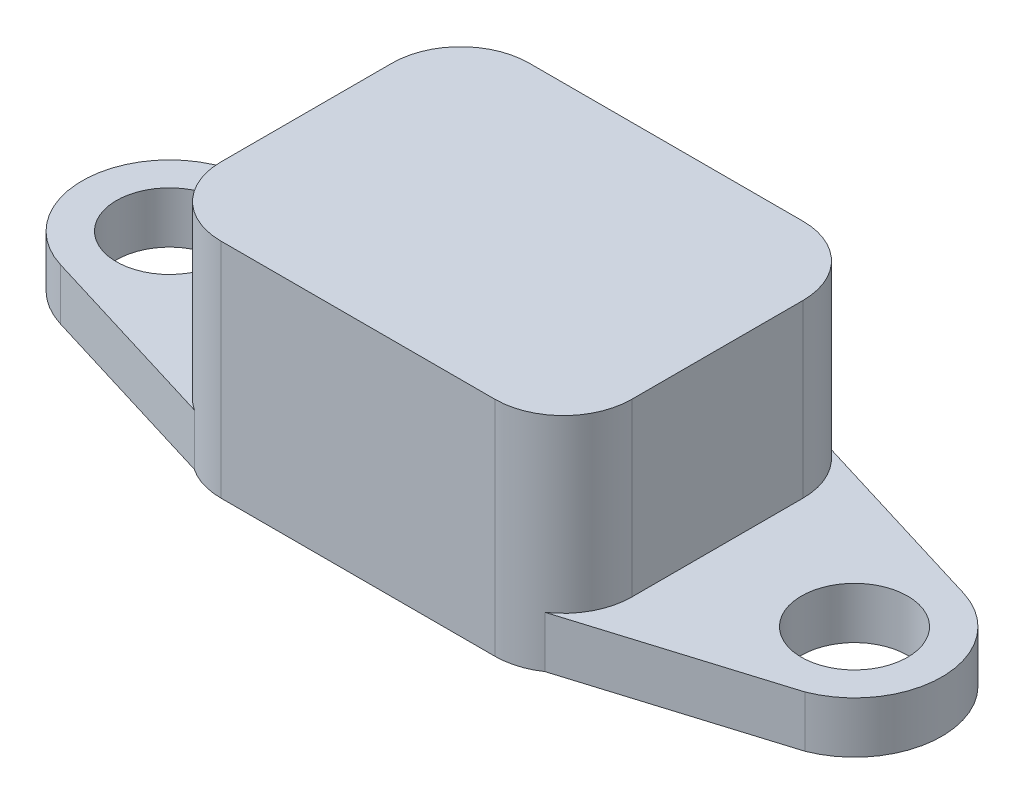
from build123d import *

# Parameters (mm, degrees)
BOSS_EXTRUDE1_DEPTH = 12
BOSS_EXTRUDE2_DEPTH = 1
SKETCH3_R           = 3.1
BOSS_EXTRUDE3_DEPTH = 3
SKETCH4_W           = 0.75982906
SKETCH4_H           = 4.341880342
SKETCH4_H_2         = 3.093589744
CUT_EXTRUDE1_DEPTH  = 0.5


with BuildPart() as part:
    # Sketch1 → Boss-Extrude1 (new body)
    with BuildSketch(Plane(origin=(0, 0, 0), x_dir=(1, 0, 0), z_dir=(0, 1, 0))):
        with BuildLine():
            Line((-8, 9), (8, 9))
            ThreePointArc((8, 9), (10.828427125, 7.828427125), (12, 5))
            Line((12, 5), (12, -5))
            ThreePointArc((12, -5), (10.828427125, -7.828427125), (8, -9))
            Line((8, -9), (-8, -9))
            ThreePointArc((-8, -9), (-10.828427125, -7.828427125), (-12, -5))
            Line((-12, -5), (-12, 5))
            ThreePointArc((-12, 5), (-10.828427125, 7.828427125), (-8, 9))
        make_face()
        with BuildLine():
            Line((-8, 8), (8, 8))
            ThreePointArc((8, 8), (10.121320344, 7.121320344), (11, 5))
            Line((11, 5), (11, -5))
            ThreePointArc((11, -5), (10.121320344, -7.121320344), (8, -8))
            Line((8, -8), (-8, -8))
            ThreePointArc((-8, -8), (-10.121320344, -7.121320344), (-11, -5))
            Line((-11, -5), (-11, 5))
            ThreePointArc((-11, 5), (-10.121320344, 7.121320344), (-8, 8))
        make_face(mode=Mode.SUBTRACT)
    extrude(amount=BOSS_EXTRUDE1_DEPTH)

    # Sketch2 → Boss-Extrude2 (add)
    with BuildSketch(Plane(origin=(0, 12, 0), x_dir=(1, 0, 0), z_dir=(0, 1, 0))):
        with BuildLine():
            Line((-8, -9), (8, -9))
            ThreePointArc((8, -9), (10.828427125, -7.828427125), (12, -5))
            Line((12, -5), (12, 5))
            ThreePointArc((12, 5), (10.828427125, 7.828427125), (8, 9))
            Line((8, 9), (-8, 9))
            ThreePointArc((-8, 9), (-10.828427125, 7.828427125), (-12, 5))
            Line((-12, 5), (-12, -5))
            ThreePointArc((-12, -5), (-10.828427125, -7.828427125), (-8, -9))
        make_face()
    extrude(amount=BOSS_EXTRUDE2_DEPTH)

    # Sketch3 → Boss-Extrude3 (add)
    # profile 1 of 2: a face of its own
    with BuildSketch(Plane.XZ):
        with BuildLine():
            Line((-11.968111741, 5.504072627), (-8, 9))
            Line((-8, 9), (-21.490501833, 4.877335777))
            ThreePointArc((-21.490501833, 4.877335777), (-25.1, 0), (-21.490501833, -4.877335777))
            Line((-21.490501833, -4.877335777), (-8, -9))
            Line((-8, -9), (-10.121320344, -7.828427125))
            Line((-10.121320344, -7.828427125), (-12, -5))
            Line((-12, -5), (-11.968111741, 5.504072627))
        make_face()
        with Locations(Location((-20, 0, 0), (0, 0, 270))):
            Circle(SKETCH3_R, mode=Mode.SUBTRACT)
    # profile 2 of 2: a face of its own
    with BuildSketch(Plane.XZ):
        with BuildLine():
            Line((21.858804444, 4.749194252), (8, 9))
            Line((8, 9), (10.279152272, 7.252036313))
            Line((10.279152272, 7.252036313), (12, 5))
            Line((12, 5), (12, -5))
            Line((12, -5), (10.721069166, -7.315709124))
            Line((10.721069166, -7.315709124), (8, -9))
            Line((8, -9), (21.490501833, -4.877335777))
            ThreePointArc((21.490501833, -4.877335777), (25.096271503, -0.194978886), (21.858804444, 4.749194252))
        make_face()
        with Locations(Location((20, 0, 0), (0, 0, 270))):
            Circle(SKETCH3_R, mode=Mode.SUBTRACT)
    extrude(amount=-BOSS_EXTRUDE3_DEPTH)

    # Sketch4 → Cut-Extrude1 (cut)
    # profile 1 of 12: a face of its own
    with BuildSketch(Plane.XZ.offset(-12)):
        with BuildLine():
            add(Edge.make_bspline(
                [(-5.748700403, 6.706559766), (-5.675098715, 6.704654086), (-5.529792312, 6.700891843), (-5.316099028, 6.669530612), (-5.110166038, 6.618431981), (-4.912086464, 6.547401188), (-4.722356273, 6.454514359), (-4.540306224, 6.342404895), (-4.366588412, 6.208956798), (-4.202982957, 6.057283192), (-4.05178201, 5.892344768), (-3.920766301, 5.714759231), (-3.809040911, 5.529128), (-3.716442609, 5.334953672), (-3.645911766, 5.130891496), (-3.596417357, 4.91798192), (-3.564619651, 4.696285514), (-3.560962425, 4.545340479), (-3.559103715, 4.468625738)],
                knots=[0, 0, 0, 0, 1.014329547, 2.002516266, 2.970391464, 3.935626869, 4.897733899, 5.877609409, 6.878433252, 7.912639331, 8.949961323, 9.958554974, 10.949718813, 11.932905612, 12.9188844, 13.919928257, 14.942845884, 16, 16, 16, 16], degree=3))
            add(Edge.make_bspline(
                [(-3.559103715, 4.468625738), (-3.561083161, 4.392775395), (-3.564983723, 4.243309861), (-3.595119235, 4.023656475), (-3.645447137, 3.813027604), (-3.714781721, 3.610946484), (-3.80570064, 3.418391928), (-3.915247263, 3.234134501), (-4.046312318, 3.059884157), (-4.194115347, 2.895734404), (-4.356833655, 2.74673328), (-4.529178174, 2.615426297), (-4.710353124, 2.504161715), (-4.900093323, 2.412990498), (-5.098805659, 2.342235875), (-5.305999288, 2.292313347), (-5.52166139, 2.261974418), (-5.668322078, 2.258099334), (-5.742764238, 2.256132416)],
                knots=[0, 0, 0, 0, 1.051557043, 2.072126891, 3.067553643, 4.050577992, 5.02905126, 6.015227836, 7.017913613, 8.04756643, 9.074058332, 10.072836633, 11.047628519, 12.017157415, 12.98668631, 13.966869689, 14.968021931, 16, 16, 16, 16], degree=3))
            add(Edge.make_bspline(
                [(-5.742764238, 2.256132416), (-5.820621812, 2.257896838), (-5.973601303, 2.261363688), (-6.197487473, 2.294331847), (-6.411989769, 2.343993411), (-6.615306249, 2.418110632), (-6.809507516, 2.510763389), (-6.993166718, 2.624870815), (-7.166222132, 2.760244338), (-7.327681085, 2.913416991), (-7.473963288, 3.08102147), (-7.603086025, 3.258080739), (-7.712003918, 3.443242221), (-7.800720952, 3.636592575), (-7.870661898, 3.836930177), (-7.919997289, 4.045475139), (-7.949140881, 4.261727295), (-7.953200415, 4.408610083), (-7.955257561, 4.483042138)],
                knots=[0, 0, 0, 0, 1.067978421, 2.098431617, 3.099715153, 4.085208694, 5.062210972, 6.048429807, 7.046490867, 8.072918869, 9.098532598, 10.095778865, 11.076610158, 12.041847152, 13.011192615, 13.984257998, 14.978533688, 16, 16, 16, 16], degree=3))
            add(Edge.make_bspline(
                [(-7.955257561, 4.483042138), (-7.95461191, 4.533116128), (-7.953328783, 4.632630056), (-7.937872171, 4.780104618), (-7.915619093, 4.924700675), (-7.882707846, 5.06584172), (-7.842729093, 5.204523437), (-7.790930971, 5.339454943), (-7.731970691, 5.472077677), (-7.663081155, 5.600825198), (-7.586482652, 5.724512923), (-7.502906865, 5.842557393), (-7.412143644, 5.95353128), (-7.314485368, 6.058163858), (-7.209595493, 6.155767368), (-7.098853737, 6.247723526), (-6.980112355, 6.331589647), (-6.855970223, 6.409413911), (-6.727127225, 6.479789043), (-6.594107871, 6.539690251), (-6.45965262, 6.592000956), (-6.321965333, 6.633286877), (-6.182521573, 6.666913827), (-6.039831667, 6.689151907), (-5.895184736, 6.704608091), (-5.797644393, 6.705907664), (-5.748700403, 6.706559766)],
                knots=[0, 0, 0, 0, 1.034744296, 2.056386356, 3.06226378, 4.057406941, 5.050368692, 6.043467995, 7.042652155, 8.049140477, 9.059438543, 10.048523776, 11.036952808, 12.020949711, 13.004946614, 13.997082645, 14.994316842, 16.007702937, 17.024872941, 18.026463647, 19.021641123, 20.005082605, 20.995858141, 21.984425357, 22.988620895, 24, 24, 24, 24], degree=3))
        make_face()
        with BuildLine():
            add(Edge.make_bspline(
                [(-5.760572732, 5.946730706), (-5.810106658, 5.9454016), (-5.907866807, 5.942778475), (-6.051263142, 5.922793816), (-6.188928688, 5.890876044), (-6.32010031, 5.84464354), (-6.445346517, 5.785801297), (-6.564889332, 5.714554917), (-6.677073334, 5.628455384), (-6.783394389, 5.532124999), (-6.879437967, 5.424790812), (-6.964295497, 5.309763976), (-7.035307583, 5.187236585), (-7.094780649, 5.058346889), (-7.139550687, 4.921645557), (-7.171439043, 4.778203386), (-7.191591293, 4.627773218), (-7.194131509, 4.525225168), (-7.195428501, 4.472865856)],
                knots=[0, 0, 0, 0, 1.033739768, 2.040188636, 3.016340934, 3.979330865, 4.937572243, 5.900995986, 6.878200029, 7.884839167, 8.891893314, 9.879764717, 10.863503415, 11.843163062, 12.837761627, 13.859916423, 14.907309254, 16, 16, 16, 16], degree=3))
            add(Edge.make_bspline(
                [(-7.195428501, 4.472865856), (-7.193708888, 4.414839959), (-7.190338731, 4.301118817), (-7.166625899, 4.135225478), (-7.126055604, 3.978555684), (-7.067472887, 3.831875684), (-6.994814948, 3.693556706), (-6.904585319, 3.565294046), (-6.798245294, 3.446319727), (-6.716321799, 3.376857564), (-6.674742069, 3.341602501)],
                knots=[0, 0, 0, 0, 1.078454662, 2.113592447, 3.107694534, 4.079536787, 5.043276885, 6.005368276, 6.987637804, 8, 8, 8, 8], degree=3))
            add(Edge.make_bspline(
                [(-6.674742069, 3.341602501), (-6.640680333, 3.315557414), (-6.573324276, 3.264054041), (-6.465809344, 3.198041902), (-6.355090135, 3.141462915), (-6.240331134, 3.095747762), (-6.121774705, 3.059788991), (-5.999437106, 3.034607655), (-5.87349168, 3.018804189), (-5.788321481, 3.016915375), (-5.745308309, 3.015961475)],
                knots=[0, 0, 0, 0, 1.023928204, 2.024787132, 3.009472467, 3.9914905, 4.972207045, 5.96565515, 6.972602802, 8, 8, 8, 8], degree=3))
            add(Edge.make_bspline(
                [(-5.745308309, 3.015961475), (-5.696626119, 3.017301851), (-5.600842381, 3.019939083), (-5.460115446, 3.03967772), (-5.325294768, 3.073082621), (-5.195543369, 3.118909556), (-5.071235394, 3.178490614), (-4.95297837, 3.251946834), (-4.84056496, 3.338376268), (-4.734379357, 3.435971682), (-4.637320696, 3.543728691), (-4.552640246, 3.659369068), (-4.479370331, 3.780344908), (-4.421134008, 3.908368442), (-4.374595207, 4.042231187), (-4.343090644, 4.182525991), (-4.322768153, 4.328674508), (-4.320227221, 4.428133738), (-4.318932775, 4.47880202)],
                knots=[0, 0, 0, 0, 1.026359118, 2.019393844, 2.989460624, 3.950973911, 4.916101784, 5.890408035, 6.881132271, 7.902007068, 8.92769091, 9.933912415, 10.920395702, 11.90457117, 12.894218921, 13.903490204, 14.931958862, 16, 16, 16, 16], degree=3))
            add(Edge.make_bspline(
                [(-4.318932775, 4.47880202), (-4.320272009, 4.529178946), (-4.322908088, 4.62833824), (-4.342681466, 4.77411101), (-4.375874522, 4.913786454), (-4.421839071, 5.047592678), (-4.480533366, 5.175660861), (-4.553114816, 5.29754064), (-4.639328742, 5.413114186), (-4.737190936, 5.52159391), (-4.843707919, 5.621279829), (-4.958064543, 5.707789085), (-5.077060982, 5.782962877), (-5.203427595, 5.841850991), (-5.334579026, 5.888767027), (-5.471315568, 5.923316668), (-5.61415512, 5.942638082), (-5.71133182, 5.945354338), (-5.760572732, 5.946730706)],
                knots=[0, 0, 0, 0, 1.055025985, 2.07665775, 3.074803781, 4.057872707, 5.035505728, 6.020516407, 7.023567878, 8.050795229, 9.077271434, 10.074415901, 11.050397877, 12.019801805, 12.988065821, 13.964604439, 14.968634123, 16, 16, 16, 16], degree=3))
        make_face(mode=Mode.SUBTRACT)
    # profile 2 of 12: a face of its own
    with BuildSketch(Plane.XZ.offset(-12)):
        with Locations((-2.582180638, 4.535619595)):
            Rectangle(SKETCH4_W, SKETCH4_H)
    # profile 3 of 12: a face of its own
    with BuildSketch(Plane.XZ.offset(-12)):
        with BuildLine():
            add(Edge.make_bspline(
                [(-1.172765574, 6.76083327), (-1.140016947, 6.759226499), (-1.075711862, 6.756071448), (-0.983586078, 6.725316721), (-0.899033278, 6.677048095), (-0.824286259, 6.610822391), (-0.762118678, 6.531736787), (-0.714620337, 6.443195195), (-0.68816099, 6.345093962), (-0.684486178, 6.277326657), (-0.682607988, 6.242690909)],
                knots=[0, 0, 0, 0, 0.989868614, 1.943702388, 2.910836514, 3.924849579, 4.949916355, 5.946401046, 6.950409252, 8, 8, 8, 8], degree=3))
            add(Edge.make_bspline(
                [(-0.682607988, 6.242690909), (-0.68441898, 6.208310407), (-0.687947782, 6.141318362), (-0.715229315, 6.0445489), (-0.760821238, 5.956050313), (-0.823492337, 5.878139277), (-0.897429002, 5.812980176), (-0.980134257, 5.763835263), (-1.071377209, 5.734791414), (-1.134684473, 5.731372619), (-1.166829409, 5.729636689)],
                knots=[0, 0, 0, 0, 1.05296456, 2.051751585, 3.055639087, 4.085634717, 5.099016424, 6.062201612, 7.016062274, 8, 8, 8, 8], degree=3))
            add(Edge.make_bspline(
                [(-1.166829409, 5.729636689), (-1.199863905, 5.731237717), (-1.264728441, 5.734381398), (-1.357609846, 5.765208084), (-1.443290364, 5.813096563), (-1.517713131, 5.880675361), (-1.58059267, 5.960322928), (-1.626016265, 6.050925845), (-1.654429847, 6.149697891), (-1.657802514, 6.218468876), (-1.659531065, 6.253715215)],
                knots=[0, 0, 0, 0, 0.989065327, 1.942068821, 2.907541208, 3.917690034, 4.939857478, 5.938239964, 6.943311734, 8, 8, 8, 8], degree=3))
            add(Edge.make_bspline(
                [(-1.659531065, 6.253715215), (-1.657649929, 6.287511915), (-1.653954708, 6.353900654), (-1.627336867, 6.449820808), (-1.580927661, 6.536873878), (-1.519207879, 6.614511746), (-1.44511739, 6.679502092), (-1.360615349, 6.726304767), (-1.269109575, 6.755789237), (-1.20521184, 6.759134565), (-1.172765574, 6.76083327)],
                knots=[0, 0, 0, 0, 1.038616768, 2.040212704, 3.031499824, 4.052181184, 5.074969369, 6.039807101, 7.004644834, 8, 8, 8, 8], degree=3))
        make_face()
    # profile 4 of 12: a face of its own
    with BuildSketch(Plane.XZ.offset(-12)):
        with Locations((-1.171069527, 3.911474296)):
            Rectangle(SKETCH4_W, SKETCH4_H_2)
    # profile 5 of 12: a face of its own
    with BuildSketch(Plane.XZ.offset(-12)):
        Polygon((-0.438377219, 5.458269168), (0.335020217, 5.458269168), (1.135554405, 3.632474563), (1.936088593, 5.458269168), (2.709486029, 5.458269168), (1.354344469, 2.364679424), (0.916764341, 2.364679424), align=None)
    # profile 6 of 12: a face of its own
    with BuildSketch(Plane.XZ.offset(-12)):
        with BuildLine():
            Line((6.261856488, 3.721517031), (3.822092866, 3.721517031))
            add(Edge.make_bspline(
                [(3.822092866, 3.721517031), (3.827067347, 3.693168362), (3.836842595, 3.63746099), (3.858069893, 3.556541199), (3.885159109, 3.480283754), (3.917623828, 3.408586717), (3.954916695, 3.341071055), (3.998415735, 3.278053441), (4.047569203, 3.219589538), (4.102092905, 3.165933435), (4.161078031, 3.117856404), (4.224238524, 3.075737886), (4.291639563, 3.041203277), (4.36250842, 3.012094186), (4.437374648, 2.989036837), (4.516348432, 2.973134621), (4.599220423, 2.963741124), (4.655675355, 2.962382463), (4.68453277, 2.961687971)],
                knots=[0, 0, 0, 0, 1.091296461, 2.144483647, 3.168565212, 4.157007626, 5.126487748, 6.090021542, 7.05641414, 8.019231907, 8.98705074, 9.938580405, 10.892824166, 11.854447369, 12.841318655, 13.858982407, 14.905600794, 16, 16, 16, 16], degree=3))
            add(Edge.make_bspline(
                [(4.68453277, 2.961687971), (4.719365629, 2.962607592), (4.787961786, 2.964418597), (4.888455667, 2.98047952), (4.985647888, 3.004738838), (5.07861867, 3.04081448), (5.168444931, 3.085722313), (5.253647857, 3.141671947), (5.335702242, 3.207028352), (5.385765087, 3.257405043), (5.411288913, 3.283088879)],
                knots=[0, 0, 0, 0, 1.021034703, 2.010718019, 2.977989445, 3.954245119, 4.929443971, 5.918328161, 6.938689359, 8, 8, 8, 8], degree=3))
            Line((5.411288913, 3.283088879), (6.047306542, 2.980344488))
            add(Edge.make_bspline(
                [(6.047306542, 2.980344488), (6.027281898, 2.952673504), (5.987603802, 2.897844466), (5.922830643, 2.820685848), (5.855235727, 2.748693728), (5.784768642, 2.682341609), (5.711340018, 2.621818567), (5.635154116, 2.566387322), (5.555097509, 2.517536182), (5.472770916, 2.472901757), (5.386472493, 2.434636872), (5.296441066, 2.402005929), (5.203057969, 2.372507834), (5.105143975, 2.350031901), (5.003514412, 2.332240136), (4.897926164, 2.319605626), (4.788393146, 2.311801895), (4.713944192, 2.310876772), (4.676052535, 2.31040592)],
                knots=[0, 0, 0, 0, 1.028154879, 2.037251081, 3.030720504, 4.000128189, 4.949298328, 5.894184978, 6.834267904, 7.770992897, 8.712077017, 9.673380525, 10.653304757, 11.658697181, 12.695551717, 13.758623199, 14.859225354, 16, 16, 16, 16], degree=3))
            add(Edge.make_bspline(
                [(4.676052535, 2.31040592), (4.617756844, 2.311594394), (4.503588093, 2.313921951), (4.336595656, 2.335525014), (4.177999158, 2.371345222), (4.027350777, 2.420037293), (3.885301717, 2.48432608), (3.751781677, 2.562956601), (3.625456601, 2.654421349), (3.510186425, 2.760639927), (3.405171894, 2.876252535), (3.312933659, 3.00041258), (3.235750017, 3.132252605), (3.172365259, 3.270900064), (3.123100422, 3.416709839), (3.087583333, 3.56974556), (3.065810931, 3.729934134), (3.063459404, 3.839040435), (3.062263807, 3.894513826)],
                knots=[0, 0, 0, 0, 1.103565453, 2.161269334, 3.182010356, 4.179077853, 5.15417608, 6.128274628, 7.109042802, 8.101804412, 9.090965879, 10.063106201, 11.02526161, 11.978650795, 12.945248442, 13.93468508, 14.949922959, 16, 16, 16, 16], degree=3))
            add(Edge.make_bspline(
                [(3.062263807, 3.894513826), (3.063471171, 3.951396866), (3.065846607, 4.063311694), (3.087395873, 4.227199096), (3.123198615, 4.383569844), (3.172607562, 4.532639277), (3.235030766, 4.67487362), (3.313196437, 4.809028495), (3.405126121, 4.935570953), (3.509762339, 5.053909019), (3.625520836, 5.160722051), (3.748525174, 5.255913809), (3.880157436, 5.3352339), (4.018928745, 5.399324485), (4.163951471, 5.451396467), (4.316901874, 5.486046022), (4.476616234, 5.509311124), (4.585793454, 5.511453695), (4.641283572, 5.512542672)],
                knots=[0, 0, 0, 0, 1.079208495, 2.12329425, 3.130605359, 4.119693003, 5.099659317, 6.073216462, 7.060498243, 8.06384408, 9.066070512, 10.045757761, 11.010926815, 11.975797609, 12.942977511, 13.929384301, 14.947594487, 16, 16, 16, 16], degree=3))
            add(Edge.make_bspline(
                [(4.641283572, 5.512542672), (4.699858539, 5.51133576), (4.81486445, 5.508966112), (4.983019938, 5.487538461), (5.142669497, 5.451499826), (5.294493325, 5.403228787), (5.436552569, 5.337315997), (5.571968701, 5.260620449), (5.697493675, 5.167178621), (5.814465452, 5.061479842), (5.920056387, 4.94421071), (6.012354564, 4.816820516), (6.090888953, 4.680552513), (6.154541854, 4.534854105), (6.203756104, 4.380162694), (6.239306071, 4.216679176), (6.260912401, 4.043781739), (6.263220172, 3.925388955), (6.264400559, 3.864833003)],
                knots=[0, 0, 0, 0, 1.080001299, 2.120471247, 3.119684163, 4.095710327, 5.052285597, 6.002875087, 6.961153713, 7.931888285, 8.906493152, 9.865905668, 10.82813294, 11.801621613, 12.7925306, 13.817193356, 14.883530496, 16, 16, 16, 16], degree=3))
            Line((6.264400559, 3.864833003), (6.261856488, 3.721517031))
        make_face()
        with BuildLine():
            add(Edge.make_bspline(
                [(5.504571499, 4.318525578), (5.49023306, 4.357219217), (5.461724508, 4.434152251), (5.397324875, 4.540301065), (5.311868623, 4.63223025), (5.212476871, 4.713615886), (5.098915572, 4.779673552), (4.974763239, 4.827501448), (4.841589135, 4.856179654), (4.749972528, 4.859543104), (4.703189287, 4.861260621)],
                knots=[0, 0, 0, 0, 0.954238005, 1.897273737, 2.851915805, 3.847685534, 4.862635127, 5.880135777, 6.917509367, 8, 8, 8, 8], degree=3))
            add(Edge.make_bspline(
                [(4.703189287, 4.861260621), (4.652094371, 4.859610736), (4.552214449, 4.856385556), (4.408144462, 4.822084582), (4.272246847, 4.770891403), (4.192129316, 4.718110148), (4.15197401, 4.69165592)],
                knots=[0, 0, 0, 0, 1.044195649, 2.041185066, 3.018232172, 4, 4, 4, 4], degree=3))
            add(Edge.make_bspline(
                [(4.15197401, 4.69165592), (4.126920097, 4.6715078), (4.073506437, 4.628553038), (4.004137962, 4.542862367), (3.935809438, 4.4391102), (3.896960904, 4.3603031), (3.876366371, 4.318525578)],
                knots=[0, 0, 0, 0, 0.82159062, 1.751589201, 2.808063854, 4, 4, 4, 4], degree=3))
            Line((3.876366371, 4.318525578), (5.504571499, 4.318525578))
        make_face(mode=Mode.SUBTRACT)
    # profile 7 of 12: a face of its own
    with BuildSketch(Plane.XZ.offset(-12)):
        with BuildLine():
            Line((6.807135601, 5.458269168), (7.458417653, 5.458269168))
            Line((7.458417653, 5.458269168), (7.458417653, 5.077506614))
            add(Edge.make_bspline(
                [(7.458417653, 5.077506614), (7.476841172, 5.111345087), (7.512850704, 5.177483786), (7.579003234, 5.266261892), (7.655001941, 5.341028336), (7.738115954, 5.403346926), (7.828597178, 5.451918148), (7.924022685, 5.486531266), (8.023576112, 5.509024997), (8.091488085, 5.511361671), (8.125812151, 5.512542672)],
                knots=[0, 0, 0, 0, 1.09866127, 2.147379032, 3.14564304, 4.131443017, 5.102343063, 6.064490016, 7.021754664, 8, 8, 8, 8], degree=3))
            add(Edge.make_bspline(
                [(8.125812151, 5.512542672), (8.150735705, 5.511375596), (8.201488961, 5.508999012), (8.278844066, 5.495183897), (8.357315268, 5.470203541), (8.408956082, 5.44771205), (8.43534073, 5.436220557)],
                knots=[0, 0, 0, 0, 0.931404136, 1.896671404, 2.925354185, 4, 4, 4, 4], degree=3))
            Line((8.43534073, 5.436220557), (8.199590195, 4.792570717))
            add(Edge.make_bspline(
                [(8.199590195, 4.792570717), (8.178517464, 4.802752042), (8.138908841, 4.821889013), (8.081403999, 4.844472611), (8.02921597, 4.858252019), (7.996129717, 4.860308027), (7.980800131, 4.861260621)],
                knots=[0, 0, 0, 0, 1.214386998, 2.282580073, 3.20428172, 4, 4, 4, 4], degree=3))
            add(Edge.make_bspline(
                [(7.980800131, 4.861260621), (7.966326021, 4.860629382), (7.937852953, 4.859387626), (7.895827501, 4.848746201), (7.856248276, 4.830395394), (7.817207959, 4.806886188), (7.781786396, 4.774206634), (7.746386712, 4.736374248), (7.715190616, 4.689665135), (7.682269687, 4.63767552), (7.654238693, 4.574040278), (7.630202978, 4.498072913), (7.608786964, 4.408894431), (7.594049822, 4.306031336), (7.579805783, 4.190479007), (7.571327381, 4.061389305), (7.565008321, 3.919170423), (7.564621953, 3.81989651), (7.564420591, 3.768158324)],
                knots=[0, 0, 0, 0, 0.544232178, 1.070598461, 1.618251235, 2.182094276, 2.777567932, 3.425210017, 4.127676488, 4.886675562, 5.738955394, 6.734782583, 7.883056018, 9.186093582, 10.642914445, 12.264202625, 14.053029461, 16, 16, 16, 16], degree=3))
            Line((7.564420591, 3.768158324), (7.566964661, 3.61721014))
            Line((7.566964661, 3.61721014), (7.566964661, 2.364679424))
            Line((7.566964661, 2.364679424), (6.807135601, 2.364679424))
            Line((6.807135601, 2.364679424), (6.807135601, 5.458269168))
        make_face()
    # profile 8 of 12: a face of its own
    with BuildSketch(Plane.XZ.offset(-12)):
        with BuildLine():
            Line((-7.738163544, -1.294722285), (-6.89014004, -1.294722285))
            add(Edge.make_bspline(
                [(-6.89014004, -1.294722285), (-6.834731284, -1.294970307), (-6.72783618, -1.295448792), (-6.573684645, -1.301251062), (-6.431472307, -1.311649083), (-6.301231838, -1.324499393), (-6.18301679, -1.342515027), (-6.076679122, -1.363168542), (-5.982196767, -1.388330533), (-5.898504295, -1.418197468), (-5.823393005, -1.453409418), (-5.7523135, -1.490912658), (-5.686872183, -1.535671452), (-5.623766033, -1.582861888), (-5.566602939, -1.636992049), (-5.511816724, -1.694459495), (-5.461727733, -1.757543337), (-5.416103874, -1.825479964), (-5.374716003, -1.897014195), (-5.338556791, -1.972273914), (-5.309226463, -2.05137821), (-5.284621964, -2.133815369), (-5.264859391, -2.219581799), (-5.251704794, -2.30920497), (-5.242769529, -2.402059099), (-5.241981116, -2.465255678), (-5.241582347, -2.497219614)],
                knots=[0, 0, 0, 0, 1.698747864, 3.27724071, 4.728299578, 6.070144658, 7.288476769, 8.393259625, 9.389771311, 10.283485332, 11.113357557, 11.931608583, 12.74405601, 13.541433047, 14.344816069, 15.154114104, 15.974336324, 16.810834471, 17.661136416, 18.50621059, 19.367396281, 20.244825668, 21.142564693, 22.063065223, 23.020325768, 24, 24, 24, 24], degree=3))
            add(Edge.make_bspline(
                [(-5.241582347, -2.497219614), (-5.242159315, -2.532580556), (-5.243293129, -2.602069152), (-5.254408152, -2.703930908), (-5.273396124, -2.80104687), (-5.29821241, -2.894236035), (-5.332816956, -2.981965233), (-5.372351024, -3.066327711), (-5.420990469, -3.144958203), (-5.47656881, -3.218840283), (-5.537266699, -3.288574646), (-5.604525101, -3.352147844), (-5.677062042, -3.409993255), (-5.754457633, -3.462717102), (-5.837002438, -3.51021303), (-5.924636898, -3.552925787), (-6.017959431, -3.589489287), (-6.082946436, -3.608611701), (-6.11589458, -3.618306687)],
                knots=[0, 0, 0, 0, 1.102006807, 2.165578795, 3.188629044, 4.184801286, 5.166646146, 6.124351954, 7.085497154, 8.042432466, 9.003981491, 9.963833307, 10.922997304, 11.89326795, 12.880200226, 13.889073926, 14.929769137, 16, 16, 16, 16], degree=3))
            add(Edge.make_bspline(
                [(-6.11589458, -3.618306687), (-6.137596124, -3.623706066), (-6.184608655, -3.63540286), (-6.262401481, -3.647278042), (-6.352049546, -3.658196541), (-6.45384274, -3.667579669), (-6.567839749, -3.67395801), (-6.693930194, -3.678939211), (-6.832171218, -3.682561058), (-6.92829856, -3.682689577), (-6.978334484, -3.682756473)],
                knots=[0, 0, 0, 0, 0.618981996, 1.340914327, 2.176866532, 3.120127938, 4.170906482, 5.338178032, 6.614476169, 8, 8, 8, 8], degree=3))
            Line((-6.978334484, -3.682756473), (-6.978334484, -5.528055619))
            Line((-6.978334484, -5.528055619), (-7.738163544, -5.528055619))
            Line((-7.738163544, -5.528055619), (-7.738163544, -1.294722285))
        make_face()
        with BuildLine():
            Line((-6.978334484, -2.922927414), (-6.709511033, -2.922927414))
            add(Edge.make_bspline(
                [(-6.709511033, -2.922927414), (-6.660594362, -2.922617244), (-6.570586961, -2.922046527), (-6.447668635, -2.913793631), (-6.348889104, -2.901189791), (-6.27085144, -2.883112969), (-6.209233313, -2.855679), (-6.156091537, -2.823943063), (-6.110510478, -2.783813841), (-6.07104399, -2.73795934), (-6.039491722, -2.685270219), (-6.017611868, -2.62660442), (-6.003399145, -2.563194573), (-6.002086468, -2.519065516), (-6.001411407, -2.496371591)],
                knots=[0, 0, 0, 0, 1.8619151, 3.425951444, 4.686033666, 5.651700536, 6.461346321, 7.243864085, 7.999046032, 8.762387399, 9.539336099, 10.322741239, 11.137448474, 12, 12, 12, 12], degree=3))
            add(Edge.make_bspline(
                [(-6.001411407, -2.496371591), (-6.002079524, -2.476544204), (-6.003375831, -2.438074306), (-6.012898857, -2.382552701), (-6.028075822, -2.330795112), (-6.050066659, -2.283342077), (-6.078495605, -2.240274228), (-6.113156244, -2.201608531), (-6.15360381, -2.166516925), (-6.184831696, -2.147942403), (-6.200696931, -2.138505672)],
                knots=[0, 0, 0, 0, 1.102301479, 2.1387299, 3.123554645, 4.094223062, 5.036071848, 5.982632524, 6.975082478, 8, 8, 8, 8], degree=3))
            add(Edge.make_bspline(
                [(-6.200696931, -2.138505672), (-6.2141357, -2.131709301), (-6.242588328, -2.117319991), (-6.291045913, -2.100591366), (-6.346965226, -2.086478928), (-6.410723785, -2.074765741), (-6.48206724, -2.065675091), (-6.560982861, -2.058723018), (-6.64758678, -2.055927318), (-6.707814624, -2.055022653), (-6.739191856, -2.054551345)],
                knots=[0, 0, 0, 0, 0.656809284, 1.390599849, 2.23162475, 3.173112763, 4.218524733, 5.370385145, 6.63003504, 8, 8, 8, 8], degree=3))
            Line((-6.739191856, -2.054551345), (-6.978334484, -2.054551345))
            Line((-6.978334484, -2.054551345), (-6.978334484, -2.922927414))
        make_face(mode=Mode.SUBTRACT)
    # profile 9 of 12: a face of its own
    with BuildSketch(Plane.XZ.offset(-12)):
        with BuildLine():
            Line((-4.698847305, -2.434465875), (-4.047565253, -2.434465875))
            Line((-4.047565253, -2.434465875), (-4.047565253, -2.815228428))
            add(Edge.make_bspline(
                [(-4.047565253, -2.815228428), (-4.029141734, -2.781389956), (-3.993132202, -2.715251257), (-3.926979672, -2.626473151), (-3.850980965, -2.551706707), (-3.767866952, -2.489388117), (-3.677385728, -2.440816895), (-3.581960221, -2.406203776), (-3.482406794, -2.383710045), (-3.414494821, -2.381373372), (-3.380170755, -2.380192371)],
                knots=[0, 0, 0, 0, 1.09866127, 2.147379032, 3.14564304, 4.131443017, 5.102343063, 6.064490016, 7.021754664, 8, 8, 8, 8], degree=3))
            add(Edge.make_bspline(
                [(-3.380170755, -2.380192371), (-3.355247201, -2.381359447), (-3.304493945, -2.38373603), (-3.22713884, -2.397551146), (-3.148667638, -2.422531502), (-3.097026824, -2.445022993), (-3.070642176, -2.456514486)],
                knots=[0, 0, 0, 0, 0.931404136, 1.896671404, 2.925354185, 4, 4, 4, 4], degree=3))
            Line((-3.070642176, -2.456514486), (-3.306392711, -3.100164326))
            add(Edge.make_bspline(
                [(-3.306392711, -3.100164326), (-3.327465442, -3.089983001), (-3.367074064, -3.07084603), (-3.424578907, -3.048262432), (-3.476766936, -3.034483024), (-3.509853189, -3.032427016), (-3.525182775, -3.031474422)],
                knots=[0, 0, 0, 0, 1.214386998, 2.282580073, 3.20428172, 4, 4, 4, 4], degree=3))
            add(Edge.make_bspline(
                [(-3.525182775, -3.031474422), (-3.539656885, -3.032105661), (-3.568129953, -3.033347417), (-3.610155405, -3.043988842), (-3.64973463, -3.062339649), (-3.688774947, -3.085848855), (-3.72419651, -3.118528409), (-3.759596194, -3.156360795), (-3.79079229, -3.203069908), (-3.823713219, -3.255059523), (-3.851744213, -3.318694764), (-3.875779928, -3.394662129), (-3.897195942, -3.483840612), (-3.911933084, -3.586703707), (-3.926177123, -3.702256036), (-3.934655525, -3.831345738), (-3.940974585, -3.97356462), (-3.941360953, -4.072838532), (-3.941562315, -4.124576719)],
                knots=[0, 0, 0, 0, 0.544232178, 1.070598461, 1.618251235, 2.182094276, 2.777567932, 3.425210017, 4.127676488, 4.886675562, 5.738955394, 6.734782583, 7.883056018, 9.186093582, 10.642914445, 12.264202625, 14.053029461, 16, 16, 16, 16], degree=3))
            Line((-3.941562315, -4.124576719), (-3.939018245, -4.275524903))
            Line((-3.939018245, -4.275524903), (-3.939018245, -5.528055619))
            Line((-3.939018245, -5.528055619), (-4.698847305, -5.528055619))
            Line((-4.698847305, -5.528055619), (-4.698847305, -2.434465875))
        make_face()
    # profile 10 of 12: a face of its own
    with BuildSketch(Plane.XZ.offset(-12)):
        with BuildLine():
            add(Edge.make_bspline(
                [(-1.216862796, -2.380192371), (-1.180939545, -2.38083165), (-1.10979523, -2.382097711), (-1.003834661, -2.392636519), (-0.899726527, -2.409831019), (-0.796872428, -2.432094895), (-0.696227461, -2.463289915), (-0.597263755, -2.500703518), (-0.49909645, -2.54365871), (-0.404162037, -2.594790413), (-0.311774686, -2.650247407), (-0.22418598, -2.711421023), (-0.142123281, -2.777830761), (-0.064063227, -2.84793686), (0.006356458, -2.924791511), (0.073635969, -3.004691534), (0.134140359, -3.090499468), (0.190158708, -3.180124372), (0.240031442, -3.273047963), (0.283336739, -3.368623832), (0.320921665, -3.465530574), (0.350349909, -3.564948579), (0.374713782, -3.66556689), (0.390089118, -3.768618509), (0.401019916, -3.873044836), (0.402245605, -3.943353233), (0.402862097, -3.978716676)],
                knots=[0, 0, 0, 0, 1.022364134, 2.024744242, 3.027414945, 4.024939316, 5.017584196, 6.023349371, 7.035562955, 8.064994934, 9.090267829, 10.101425541, 11.102933353, 12.093946398, 13.084502048, 14.067315274, 15.065326281, 16.070028806, 17.074376865, 18.064572984, 19.055292013, 20.030201733, 21.013838017, 21.999348303, 22.993720005, 24, 24, 24, 24], degree=3))
            add(Edge.make_bspline(
                [(0.402862097, -3.978716676), (0.402211492, -4.014356397), (0.400917941, -4.08521624), (0.390484581, -4.190624826), (0.373224266, -4.294161048), (0.350874941, -4.396434857), (0.319796661, -4.49613756), (0.283485009, -4.594738816), (0.238911027, -4.690894651), (0.189631206, -4.785654037), (0.133252682, -4.876228493), (0.072800666, -4.962896015), (0.005802954, -5.043382908), (-0.064053002, -5.120185293), (-0.140080627, -5.190706059), (-0.221066381, -5.256090274), (-0.306309149, -5.317137289), (-0.396421919, -5.372414826), (-0.490250496, -5.420985227), (-0.586212478, -5.464775407), (-0.684868998, -5.501233859), (-0.786015881, -5.530964722), (-0.889714468, -5.553984585), (-0.995735821, -5.569622252), (-1.103851609, -5.58049807), (-1.17669577, -5.581714843), (-1.213470702, -5.582329123)],
                knots=[0, 0, 0, 0, 1.012026251, 2.012137606, 3.004615893, 3.992048833, 4.982446996, 5.968083444, 6.973977695, 7.990229942, 8.999482246, 10.001782172, 10.988562221, 11.971415814, 12.948383116, 13.930088534, 14.925840678, 15.924049238, 16.929462851, 17.924729459, 18.917889337, 19.913673841, 20.916777188, 21.931792057, 22.95587778, 24, 24, 24, 24], degree=3))
            add(Edge.make_bspline(
                [(-1.213470702, -5.582329123), (-1.267243152, -5.580750796), (-1.373229468, -5.577639888), (-1.529322256, -5.556330986), (-1.679275897, -5.51965278), (-1.82333474, -5.468524168), (-1.961685921, -5.403004758), (-2.093122021, -5.321914538), (-2.218950471, -5.226849943), (-2.336991829, -5.118614466), (-2.445133703, -4.999870347), (-2.539608641, -4.873111724), (-2.619825509, -4.740238495), (-2.685712135, -4.60109914), (-2.736563175, -4.455502861), (-2.773286303, -4.30388494), (-2.794621257, -4.145819202), (-2.797705853, -4.03842478), (-2.799274655, -3.983804817)],
                knots=[0, 0, 0, 0, 1.029999031, 2.030143771, 3.011211297, 3.982305373, 4.953580601, 5.938004764, 6.935448627, 7.970290061, 9.001484052, 10.007591832, 10.993831261, 11.969999897, 12.951306496, 13.942897864, 14.953773953, 16, 16, 16, 16], degree=3))
            add(Edge.make_bspline(
                [(-2.799274655, -3.983804817), (-2.797651145, -3.925482671), (-2.794460167, -3.810851659), (-2.769122403, -3.642914615), (-2.728660728, -3.482122854), (-2.670580542, -3.328926161), (-2.596388212, -3.183041987), (-2.505816191, -3.044778017), (-2.398416867, -2.914102933), (-2.316170491, -2.835066162), (-2.274348106, -2.794875864)],
                knots=[0, 0, 0, 0, 1.043912699, 2.05178951, 3.033892, 4.007821512, 4.978932272, 5.95884105, 6.962068106, 8, 8, 8, 8], degree=3))
            add(Edge.make_bspline(
                [(-2.274348106, -2.794875864), (-2.235971886, -2.761562629), (-2.16026355, -2.69584251), (-2.037262421, -2.612487315), (-1.911323144, -2.540493856), (-1.780936283, -2.481301843), (-1.645738354, -2.43667202), (-1.506422168, -2.404185502), (-1.363016695, -2.384231331), (-1.265828341, -2.381545533), (-1.216862796, -2.380192371)],
                knots=[0, 0, 0, 0, 1.048115528, 2.067714963, 3.060638214, 4.039924844, 5.017819947, 5.994373833, 6.98952318, 8, 8, 8, 8], degree=3))
        make_face()
        with BuildLine():
            add(Edge.make_bspline(
                [(-1.199902326, -3.085747926), (-1.229320822, -3.0867257), (-1.287231448, -3.088650457), (-1.372477411, -3.098980116), (-1.453103941, -3.120151639), (-1.530712431, -3.147076022), (-1.603929978, -3.183083591), (-1.674761751, -3.225220744), (-1.739524653, -3.277950207), (-1.801352769, -3.335790569), (-1.857478916, -3.400020739), (-1.905303723, -3.469999462), (-1.948036248, -3.543049497), (-1.980438154, -3.621845298), (-2.00725383, -3.704233147), (-2.025402357, -3.791544181), (-2.038032465, -3.882803088), (-2.038970071, -3.945316065), (-2.039445595, -3.977020629)],
                knots=[0, 0, 0, 0, 1.030650113, 2.02884584, 2.99876339, 3.944280128, 4.900564847, 5.851248946, 6.823638398, 7.81794922, 8.81432732, 9.802856497, 10.78262424, 11.771747962, 12.779760563, 13.812642396, 14.89064281, 16, 16, 16, 16], degree=3))
            add(Edge.make_bspline(
                [(-2.039445595, -3.977020629), (-2.038889168, -4.009843256), (-2.037801737, -4.073988778), (-2.026541165, -4.167649865), (-2.00797211, -4.256533615), (-1.981591302, -4.340502724), (-1.948412982, -4.42015991), (-1.907707031, -4.495058242), (-1.859043843, -4.564747387), (-1.803871599, -4.629141527), (-1.743460348, -4.6875928), (-1.677266422, -4.737753495), (-1.608061774, -4.781336482), (-1.534251553, -4.816340348), (-1.456884074, -4.843366172), (-1.375729667, -4.863264377), (-1.290361865, -4.873984566), (-1.232154515, -4.875831117), (-1.202446396, -4.876773567)],
                knots=[0, 0, 0, 0, 1.141730614, 2.231293227, 3.276944405, 4.297399982, 5.28939179, 6.275415646, 7.257752684, 8.24146775, 9.222424823, 10.176631434, 11.126518621, 12.063689483, 13.012557477, 13.974037417, 14.965980454, 16, 16, 16, 16], degree=3))
            add(Edge.make_bspline(
                [(-1.202446396, -4.876773567), (-1.172723419, -4.875937656), (-1.114449129, -4.874298785), (-1.028981078, -4.862026227), (-0.947412237, -4.84271164), (-0.86938398, -4.815453214), (-0.795527172, -4.77970011), (-0.725559084, -4.735908616), (-0.658864197, -4.68505023), (-0.597642222, -4.625496093), (-0.54097021, -4.560901131), (-0.491272245, -4.490844102), (-0.449742751, -4.41594575), (-0.41568113, -4.336677337), (-0.389248607, -4.253147815), (-0.370986966, -4.165046717), (-0.358350106, -4.072647073), (-0.357433704, -4.009289774), (-0.356966963, -3.977020629)],
                knots=[0, 0, 0, 0, 1.031504075, 2.022346795, 2.991027682, 3.937587355, 4.885570121, 5.833146507, 6.798790848, 7.791235734, 8.792807298, 9.778388351, 10.766749885, 11.760164525, 12.768777521, 13.802286646, 14.880660483, 16, 16, 16, 16], degree=3))
            add(Edge.make_bspline(
                [(-0.356966963, -3.977020629), (-0.357530469, -3.944762763), (-0.35863625, -3.881462366), (-0.369897625, -3.788937753), (-0.388284448, -3.701121422), (-0.41500551, -3.618388341), (-0.447986623, -3.539794657), (-0.48872071, -3.465742661), (-0.537623889, -3.396597078), (-0.593064341, -3.33270077), (-0.654381194, -3.275069701), (-0.719425834, -3.223676778), (-0.789685631, -3.181170882), (-0.863842469, -3.14613085), (-0.942093644, -3.119172548), (-1.024351307, -3.099161574), (-1.110867552, -3.088593929), (-1.169913894, -3.086706509), (-1.199902326, -3.085747926)],
                knots=[0, 0, 0, 0, 1.123894411, 2.205445421, 3.243160173, 4.246488011, 5.231014757, 6.210004299, 7.185865357, 8.177612767, 9.153374344, 10.115157457, 11.061423229, 12.009021698, 12.96873347, 13.94135618, 14.954456845, 16, 16, 16, 16], degree=3))
        make_face(mode=Mode.SUBTRACT)
    # profile 11 of 12: a face of its own
    with BuildSketch(Plane.XZ.offset(-12)):
        with BuildLine():
            add(Edge.make_bspline(
                [(2.528008999, -2.380192371), (2.56393225, -2.38083165), (2.635076565, -2.382097711), (2.741037134, -2.392636519), (2.845145268, -2.409831019), (2.947999367, -2.432094895), (3.048644334, -2.463289915), (3.147608039, -2.500703518), (3.245775345, -2.54365871), (3.340709758, -2.594790413), (3.433097109, -2.650247407), (3.520685815, -2.711421023), (3.602748514, -2.777830761), (3.680808568, -2.84793686), (3.751228253, -2.924791511), (3.818507764, -3.004691534), (3.879012154, -3.090499468), (3.935030503, -3.180124372), (3.984903237, -3.273047963), (4.028208534, -3.368623832), (4.06579346, -3.465530574), (4.095221704, -3.564948579), (4.119585577, -3.66556689), (4.134960913, -3.768618509), (4.145891711, -3.873044836), (4.1471174, -3.943353233), (4.147733892, -3.978716676)],
                knots=[0, 0, 0, 0, 1.022364134, 2.024744242, 3.027414945, 4.024939316, 5.017584196, 6.023349371, 7.035562955, 8.064994934, 9.090267829, 10.101425541, 11.102933353, 12.093946398, 13.084502048, 14.067315274, 15.065326281, 16.070028806, 17.074376865, 18.064572984, 19.055292013, 20.030201733, 21.013838017, 21.999348303, 22.993720005, 24, 24, 24, 24], degree=3))
            add(Edge.make_bspline(
                [(4.147733892, -3.978716676), (4.147083287, -4.014356397), (4.145789736, -4.08521624), (4.135356376, -4.190624826), (4.118096061, -4.294161048), (4.095746736, -4.396434857), (4.064668456, -4.49613756), (4.028356804, -4.594738816), (3.983782822, -4.690894651), (3.934503001, -4.785654037), (3.878124477, -4.876228493), (3.817672461, -4.962896015), (3.750674749, -5.043382908), (3.680818793, -5.120185293), (3.604791167, -5.190706059), (3.523805414, -5.256090274), (3.438562646, -5.317137289), (3.348449876, -5.372414826), (3.254621299, -5.420985227), (3.158659317, -5.464775407), (3.060002797, -5.501233859), (2.958855914, -5.530964722), (2.855157327, -5.553984585), (2.749135973, -5.569622252), (2.641020186, -5.58049807), (2.568176025, -5.581714843), (2.531401093, -5.582329123)],
                knots=[0, 0, 0, 0, 1.012026251, 2.012137606, 3.004615893, 3.992048833, 4.982446996, 5.968083444, 6.973977695, 7.990229942, 8.999482246, 10.001782172, 10.988562221, 11.971415814, 12.948383116, 13.930088534, 14.925840678, 15.924049238, 16.929462851, 17.924729459, 18.917889337, 19.913673841, 20.916777188, 21.931792057, 22.95587778, 24, 24, 24, 24], degree=3))
            add(Edge.make_bspline(
                [(2.531401093, -5.582329123), (2.477628643, -5.580750796), (2.371642326, -5.577639888), (2.215549539, -5.556330986), (2.065595898, -5.51965278), (1.921537055, -5.468524168), (1.783185874, -5.403004758), (1.651749774, -5.321914538), (1.525921323, -5.226849943), (1.407879966, -5.118614466), (1.299738092, -4.999870347), (1.205263154, -4.873111724), (1.125046286, -4.740238495), (1.05915966, -4.60109914), (1.00830862, -4.455502861), (0.971585492, -4.30388494), (0.950250538, -4.145819202), (0.947165942, -4.03842478), (0.94559714, -3.983804817)],
                knots=[0, 0, 0, 0, 1.029999031, 2.030143771, 3.011211297, 3.982305373, 4.953580601, 5.938004764, 6.935448627, 7.970290061, 9.001484052, 10.007591832, 10.993831261, 11.969999897, 12.951306496, 13.942897864, 14.953773953, 16, 16, 16, 16], degree=3))
            add(Edge.make_bspline(
                [(0.94559714, -3.983804817), (0.94722065, -3.925482671), (0.950411628, -3.810851659), (0.975749391, -3.642914615), (1.016211067, -3.482122854), (1.074291253, -3.328926161), (1.148483583, -3.183041987), (1.239055604, -3.044778017), (1.346454927, -2.914102933), (1.428701303, -2.835066162), (1.470523689, -2.794875864)],
                knots=[0, 0, 0, 0, 1.043912699, 2.05178951, 3.033892, 4.007821512, 4.978932272, 5.95884105, 6.962068106, 8, 8, 8, 8], degree=3))
            add(Edge.make_bspline(
                [(1.470523689, -2.794875864), (1.508899908, -2.761562629), (1.584608245, -2.69584251), (1.707609374, -2.612487315), (1.833548651, -2.540493856), (1.963935511, -2.481301843), (2.099133441, -2.43667202), (2.238449627, -2.404185502), (2.3818551, -2.384231331), (2.479043454, -2.381545533), (2.528008999, -2.380192371)],
                knots=[0, 0, 0, 0, 1.048115528, 2.067714963, 3.060638214, 4.039924844, 5.017819947, 5.994373833, 6.98952318, 8, 8, 8, 8], degree=3))
        make_face()
        with BuildLine():
            add(Edge.make_bspline(
                [(2.544969469, -3.085747926), (2.515550973, -3.0867257), (2.457640347, -3.088650457), (2.372394384, -3.098980116), (2.291767854, -3.120151639), (2.214159364, -3.147076022), (2.140941817, -3.183083591), (2.070110044, -3.225220744), (2.005347142, -3.277950207), (1.943519026, -3.335790569), (1.887392879, -3.400020739), (1.839568072, -3.469999462), (1.796835547, -3.543049497), (1.76443364, -3.621845298), (1.737617965, -3.704233147), (1.719469438, -3.791544181), (1.70683933, -3.882803088), (1.705901724, -3.945316065), (1.7054262, -3.977020629)],
                knots=[0, 0, 0, 0, 1.030650113, 2.02884584, 2.99876339, 3.944280128, 4.900564847, 5.851248946, 6.823638398, 7.81794922, 8.81432732, 9.802856497, 10.78262424, 11.771747962, 12.779760563, 13.812642396, 14.89064281, 16, 16, 16, 16], degree=3))
            add(Edge.make_bspline(
                [(1.7054262, -3.977020629), (1.705982627, -4.009843256), (1.707070058, -4.073988778), (1.71833063, -4.167649865), (1.736899685, -4.256533615), (1.763280493, -4.340502724), (1.796458813, -4.42015991), (1.837164764, -4.495058242), (1.885827952, -4.564747387), (1.941000196, -4.629141527), (2.001411447, -4.6875928), (2.067605372, -4.737753495), (2.136810021, -4.781336482), (2.210620242, -4.816340348), (2.287987721, -4.843366172), (2.369142128, -4.863264377), (2.45450993, -4.873984566), (2.51271728, -4.875831117), (2.542425398, -4.876773567)],
                knots=[0, 0, 0, 0, 1.141730614, 2.231293227, 3.276944405, 4.297399982, 5.28939179, 6.275415646, 7.257752684, 8.24146775, 9.222424823, 10.176631434, 11.126518621, 12.063689483, 13.012557477, 13.974037417, 14.965980454, 16, 16, 16, 16], degree=3))
            add(Edge.make_bspline(
                [(2.542425398, -4.876773567), (2.572148376, -4.875937656), (2.630422666, -4.874298785), (2.715890717, -4.862026227), (2.797459558, -4.84271164), (2.875487815, -4.815453214), (2.949344622, -4.77970011), (3.019312711, -4.735908616), (3.086007597, -4.68505023), (3.147229573, -4.625496093), (3.203901585, -4.560901131), (3.25359955, -4.490844102), (3.295129044, -4.41594575), (3.329190665, -4.336677337), (3.355623188, -4.253147815), (3.373884828, -4.165046717), (3.386521689, -4.072647073), (3.38743809, -4.009289774), (3.387904832, -3.977020629)],
                knots=[0, 0, 0, 0, 1.031504075, 2.022346795, 2.991027682, 3.937587355, 4.885570121, 5.833146507, 6.798790848, 7.791235734, 8.792807298, 9.778388351, 10.766749885, 11.760164525, 12.768777521, 13.802286646, 14.880660483, 16, 16, 16, 16], degree=3))
            add(Edge.make_bspline(
                [(3.387904832, -3.977020629), (3.387341326, -3.944762763), (3.386235545, -3.881462366), (3.37497417, -3.788937753), (3.356587347, -3.701121422), (3.329866285, -3.618388341), (3.296885172, -3.539794657), (3.256151085, -3.465742661), (3.207247906, -3.396597078), (3.151807454, -3.33270077), (3.090490601, -3.275069701), (3.025445961, -3.223676778), (2.955186164, -3.181170882), (2.881029326, -3.14613085), (2.802778151, -3.119172548), (2.720520488, -3.099161574), (2.634004243, -3.088593929), (2.574957901, -3.086706509), (2.544969469, -3.085747926)],
                knots=[0, 0, 0, 0, 1.123894411, 2.205445421, 3.243160173, 4.246488011, 5.231014757, 6.210004299, 7.185865357, 8.177612767, 9.153374344, 10.115157457, 11.061423229, 12.009021698, 12.96873347, 13.94135618, 14.954456845, 16, 16, 16, 16], degree=3))
        make_face(mode=Mode.SUBTRACT)
    # profile 12 of 12: a face of its own
    with BuildSketch(Plane.XZ.offset(-12)):
        with BuildLine():
            Line((4.419101413, -2.434465875), (4.690468935, -2.434465875))
            add(Edge.make_bspline(
                [(4.690468935, -2.434465875), (4.690650283, -2.385279535), (4.690993188, -2.292274853), (4.693018326, -2.16055435), (4.694383977, -2.04464643), (4.69682333, -1.94456892), (4.700256459, -1.860614965), (4.703775779, -1.792789154), (4.706411986, -1.740663546), (4.710128688, -1.711372635), (4.711669522, -1.699229497)],
                knots=[0, 0, 0, 0, 1.604323161, 3.033556972, 4.296844687, 5.385167547, 6.298701784, 7.037230881, 7.60086462, 8, 8, 8, 8], degree=3))
            add(Edge.make_bspline(
                [(4.711669522, -1.699229497), (4.718894678, -1.657567921), (4.732978951, -1.576355409), (4.779602442, -1.463161614), (4.847350133, -1.36455686), (4.919166845, -1.294956412), (4.985722525, -1.247441948), (5.04155721, -1.216408551), (5.102267256, -1.189803444), (5.168048815, -1.168941852), (5.238276262, -1.151900598), (5.313707472, -1.140054363), (5.393928604, -1.133526049), (5.449155703, -1.132451828), (5.477434747, -1.131901773)],
                knots=[0, 0, 0, 0, 1.43722947, 2.801646624, 4.13175475, 5.486897933, 6.18427957, 6.91287343, 7.658885333, 8.438447905, 9.260561323, 10.118602268, 11.036630026, 12, 12, 12, 12], degree=3))
            add(Edge.make_bspline(
                [(5.477434747, -1.131901773), (5.520762891, -1.133253893), (5.611006703, -1.136070087), (5.749658979, -1.158837285), (5.896759371, -1.193690179), (5.995793585, -1.226122881), (6.047306542, -1.242992852)],
                knots=[0, 0, 0, 0, 0.891275659, 1.856347963, 2.884972697, 4, 4, 4, 4], degree=3))
            Line((6.047306542, -1.242992852), (6.047306542, -1.834065234))
            add(Edge.make_bspline(
                [(6.047306542, -1.834065234), (6.019676804, -1.826426077), (5.966980718, -1.811856498), (5.8911594, -1.795682971), (5.822842092, -1.785695857), (5.779923618, -1.783984967), (5.759826574, -1.783183824)],
                knots=[0, 0, 0, 0, 1.174725213, 2.24046353, 3.176077791, 4, 4, 4, 4], degree=3))
            add(Edge.make_bspline(
                [(5.759826574, -1.783183824), (5.737708362, -1.783649924), (5.696262242, -1.784523324), (5.638811888, -1.795634673), (5.589622136, -1.813129986), (5.564108037, -1.833110901), (5.552060815, -1.842545469)],
                knots=[0, 0, 0, 0, 1.199997209, 2.248609783, 3.173030359, 4, 4, 4, 4], degree=3))
            add(Edge.make_bspline(
                [(5.552060815, -1.842545469), (5.544770744, -1.851857918), (5.528664596, -1.87243216), (5.51402514, -1.914415237), (5.506592851, -1.967478141), (5.505286974, -2.006747438), (5.504571499, -2.028262617)],
                knots=[0, 0, 0, 0, 0.721105823, 1.593158367, 2.681320256, 4, 4, 4, 4], degree=3))
            Line((5.504571499, -2.028262617), (5.502027428, -2.434465875))
            Line((5.502027428, -2.434465875), (5.993033037, -2.434465875))
            Line((5.993033037, -2.434465875), (5.993033037, -3.085747926))
            Line((5.993033037, -3.085747926), (5.450297995, -3.085747926))
            Line((5.450297995, -3.085747926), (5.450297995, -5.528055619))
            Line((5.450297995, -5.528055619), (4.690468935, -5.528055619))
            Line((4.690468935, -5.528055619), (4.690468935, -3.085747926))
            Line((4.690468935, -3.085747926), (4.419101413, -3.085747926))
            Line((4.419101413, -3.085747926), (4.419101413, -2.434465875))
        make_face()
    extrude(amount=-CUT_EXTRUDE1_DEPTH, mode=Mode.SUBTRACT)


solid = part.part
